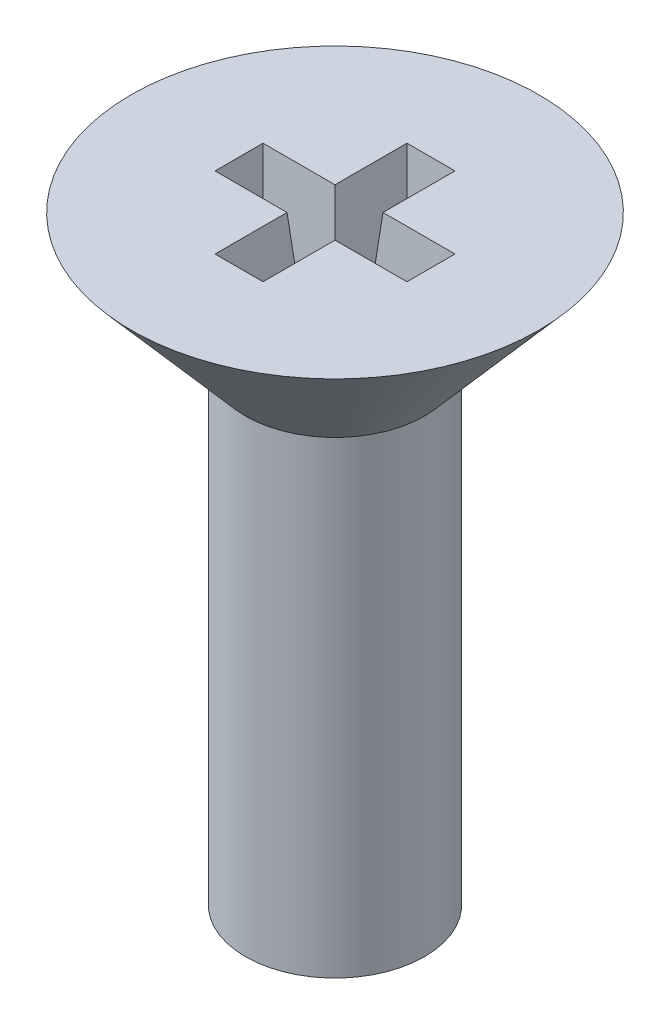
from build123d import *

# Parameters (mm, degrees)
CUT_EXTRUDE1_DEPTH = 2.159
CUT_EXTRUDE1_DRAFT = -5


with BuildPart() as part:
    # Sketch1 → Revolve1 (revolve)
    with BuildSketch(Plane.XY, mode=Mode.PRIVATE) as revolve1_sk:
        Polygon((1.4224, 0), (3.2385, 2.089184064), (0, 2.089184064), (0, 0), (0, -7.435815936), (1.4224, -7.435815936), align=None)
    revolve(revolve1_sk.sketch.rotate(Axis((0, 0, 0), (0, -1, 0)), 180), axis=Axis((0, 0, 0), (0, -1, 0)))


with BuildPart() as cut_extrude1_tool:
    # Sketch2 → Cut-Extrude1 (with draft: the straight prism first)
    with BuildSketch(Plane(origin=(0, 2.089184064, 0), x_dir=(1, 0, 0), z_dir=(0, 1, 0))):
        Polygon((-0.381, 1.524), (-0.381, 0.381), (-1.524, 0.381), (-1.524, -0.381), (-0.381, -0.381), (-0.381, -1.524), (0.381, -1.524), (0.381, -0.381), (1.524, -0.381), (1.524, 0.381), (0.381, 0.381), (0.381, 1.524), align=None)
    extrude(amount=-CUT_EXTRUDE1_DEPTH)
    # Cut-Extrude1: the draft: its side faces are tilted about the plane it starts from
    cut_extrude1_sides = [cut_extrude1_tool.faces().sort_by_distance(p)[0] for p in [
        (-0.381, 1.009684064, -0.9525),
        (-0.9525, 1.009684064, -0.381),
        (-1.524, 1.009684064, 0),
        (-0.9525, 1.009684064, 0.381),
        (-0.381, 1.009684064, 0.9525),
        (0, 1.009684064, 1.524),
        (0.381, 1.009684064, 0.9525),
        (0.9525, 1.009684064, 0.381),
        (1.524, 1.009684064, 0),
        (0.9525, 1.009684064, -0.381),
        (0.381, 1.009684064, -0.9525),
        (0, 1.009684064, -1.524),
    ]]
    draft(cut_extrude1_sides, Plane(origin=(0, 2.089184064, 0), x_dir=(1, 0, 0), z_dir=(0, 1, 0)), CUT_EXTRUDE1_DRAFT)


with BuildPart() as part_1:
    add(part.part)

    # Cut-Extrude1: cut by cut_extrude1_tool
    add(cut_extrude1_tool.part, mode=Mode.SUBTRACT)


solid = part_1.part
